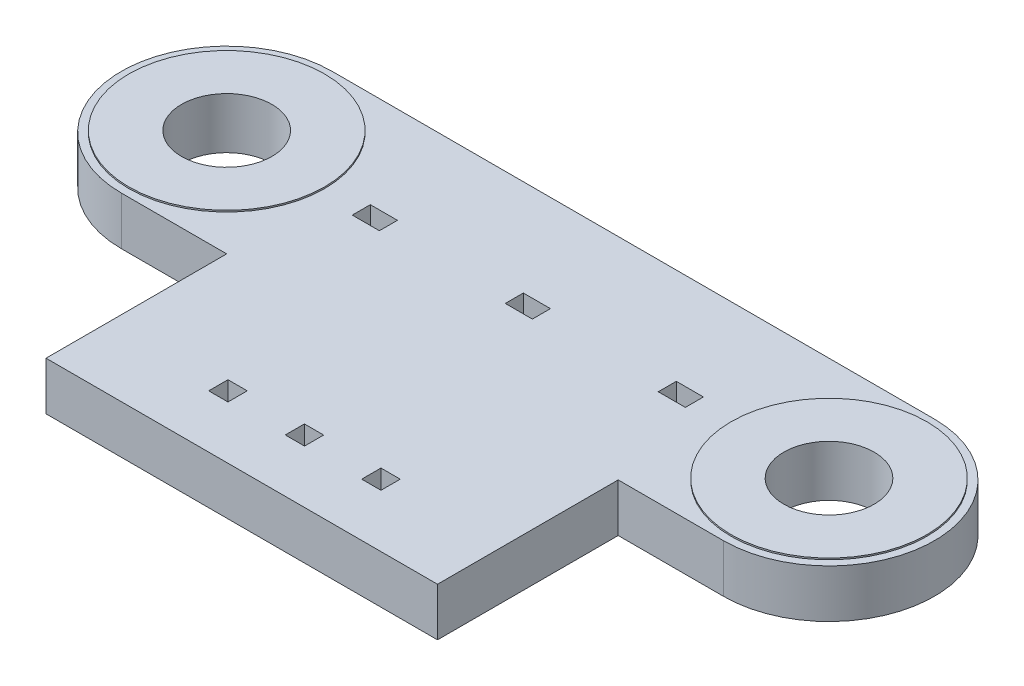
from build123d import *
from build123d.topology import SkipClean

# Parameters (mm, degrees)
BOSS_EXTRUDE1_DEPTH      = 0.8
BOSS_EXTRUDE1_DEPTH_BACK = 0.8
SKETCH1_R                = 1.5
SKETCH4_R                = 3.25
SKETCH4_R_2              = 1.5
BOSS_EXTRUDE4_DEPTH      = 0.05
SKETCH5_W                = 0.64
SKETCH5_H                = 0.635
SKETCH5_H_2              = 0.64
CUT_EXTRUDE1_DEPTH       = 1.6
SKETCH6_W                = 0.9
SKETCH6_H                = 0.6
CUT_EXTRUDE2_DEPTH       = 1.6


with BuildPart() as part:
    # Sketch1 → Boss-Extrude1 (new, two sides: drawn at the far end of the back side and taken through both)
    with BuildSketch(Plane(origin=(0, 0, 0), x_dir=(1, 0, 0), z_dir=(0, 1, 0)).offset(-BOSS_EXTRUDE1_DEPTH_BACK)):
        with BuildLine():
            Line((-10, 3.5), (10, 3.5))
            ThreePointArc((10, 3.5), (13.5, 0), (10, -3.5))
            Line((10, -3.5), (6.5, -3.5))
            Line((6.5, -3.5), (6.5, -9.5))
            Line((6.5, -9.5), (-6.5, -9.5))
            Line((-6.5, -9.5), (-6.5, -3.5))
            Line((-6.5, -3.5), (-10, -3.5))
            ThreePointArc((-10, -3.5), (-13.5, 0), (-10, 3.5))
        make_face()
        with Locations(Location((-10, 0, 0), (0, 0, 270))):
            Circle(SKETCH1_R, mode=Mode.SUBTRACT)
        with Locations(Location((10, 0, 0), (0, 0, 90))):
            Circle(SKETCH1_R, mode=Mode.SUBTRACT)
    extrude(amount=BOSS_EXTRUDE1_DEPTH + BOSS_EXTRUDE1_DEPTH_BACK)

    # Sketch4 → Boss-Extrude4 (add)
    # profile 1 of 2: a face of its own
    with BuildSketch(Plane(origin=(0, 0.8, 0), x_dir=(1, 0, 0), z_dir=(0, 1, 0))):
        with Locations(Location((-10, 0, 0), (0, 0, 270))):
            Circle(SKETCH4_R)
        with Locations(Location((-10, 0, 0), (0, 0, 270))):
            Circle(SKETCH4_R_2, mode=Mode.SUBTRACT)
    # profile 2 of 2: a face of its own
    with BuildSketch(Plane(origin=(0, 0.8, 0), x_dir=(1, 0, 0), z_dir=(0, 1, 0))):
        with Locations(Location((10, 0, 0), (0, 0, 90))):
            Circle(SKETCH4_R)
        with Locations(Location((10, 0, 0), (0, 0, 270))):
            Circle(SKETCH4_R_2, mode=Mode.SUBTRACT)
    boss_extrude4 = extrude(amount=BOSS_EXTRUDE4_DEPTH)

    # Mirror1: Boss-Extrude4 across plane
    with SkipClean():  # the faces are left unmerged after this step: merging them gives an invalid solid
        add(boss_extrude4.mirror(Plane.ZX))

    # Sketch5 → Cut-Extrude1 (cut)
    with SkipClean():  # the faces are left unmerged after this step: merging them gives an invalid solid
        with BuildSketch(Plane(origin=(0, 0.8, 0), x_dir=(1, 0, 0), z_dir=(0, 1, 0))):
            with Locations((0, -7.4175)):
                Rectangle(SKETCH5_W, SKETCH5_H)
            with Locations((-2.54, -7.4175)):
                Rectangle(SKETCH5_W, SKETCH5_H_2)
            with Locations((2.54, -7.4175)):
                Rectangle(SKETCH5_W, SKETCH5_H_2)
        extrude(amount=-CUT_EXTRUDE1_DEPTH, mode=Mode.SUBTRACT)

    # Sketch6 → Cut-Extrude2 (cut)
    with SkipClean():  # the faces are left unmerged after this step: merging them gives an invalid solid
        with BuildSketch(Plane(origin=(0, 0.8, 0), x_dir=(1, 0, 0), z_dir=(0, 1, 0))):
            Rectangle(SKETCH6_W, SKETCH6_H)
            with Locations((-5.08, 0)):
                Rectangle(SKETCH6_W, SKETCH6_H)
            with Locations((5.08, 0)):
                Rectangle(SKETCH6_W, SKETCH6_H)
        extrude(amount=-CUT_EXTRUDE2_DEPTH, mode=Mode.SUBTRACT)


solid = part.part
